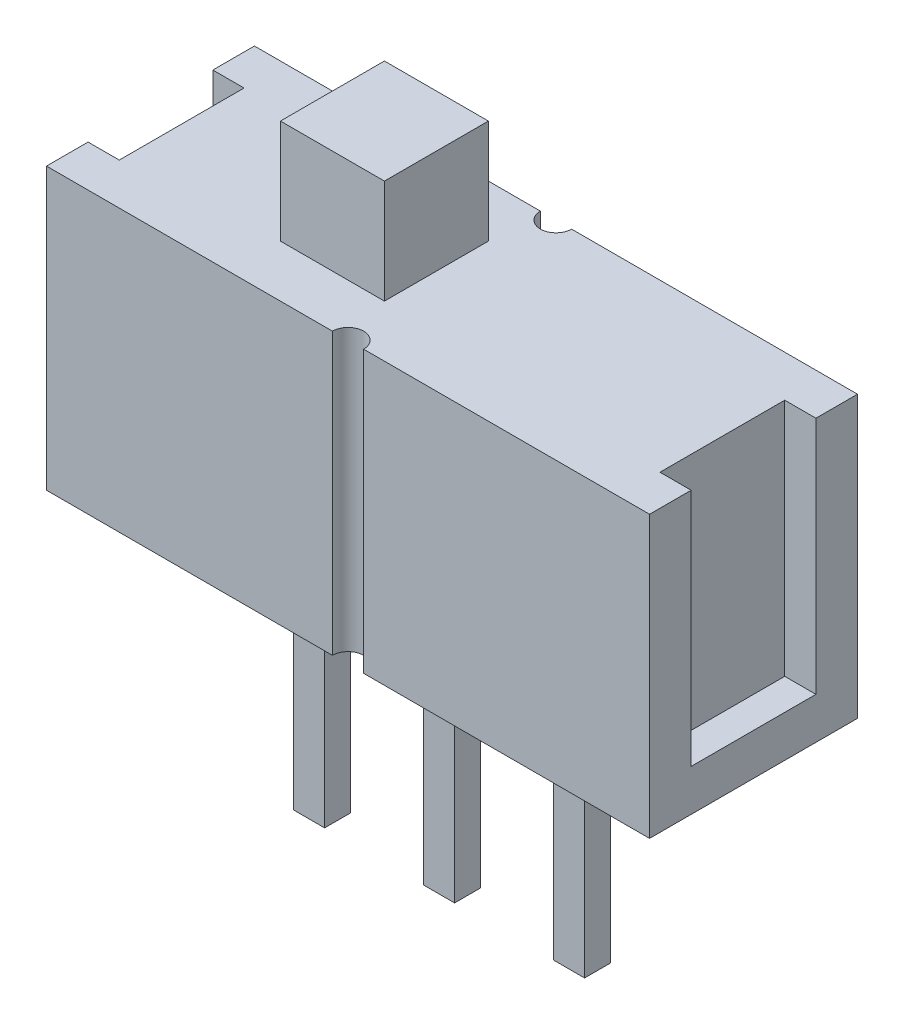
from build123d import *

# Parameters (mm, degrees)
BOSS_EXTRUDE1_DEPTH = 5.4
SKETCH3_W           = 0.6
SKETCH3_H           = 0.5
BOSS_EXTRUDE3_DEPTH = 4.7
SKETCH4_W           = 2
SKETCH4_H           = 2
BOSS_EXTRUDE4_DEPTH = 2
SKETCH5_W           = 1.2
SKETCH5_H           = 2.4
CUT_EXTRUDE1_DEPTH  = 4.6


with BuildPart() as part:
    # Sketch1 → Boss-Extrude1 (new body)
    with BuildSketch(Plane(origin=(0, 0, 0), x_dir=(1, 0, 0), z_dir=(0, 1, 0))):
        with BuildLine():
            Line((-5.8, -2), (-0.3, -2))
            ThreePointArc((-0.3, -2), (0, -1.7), (0.3, -2))
            Line((0.3, -2), (5.8, -2))
            Line((5.8, -2), (5.8, 2))
            Line((5.8, 2), (0.3, 2))
            ThreePointArc((0.3, 2), (0, 1.7), (-0.3, 2))
            Line((-0.3, 2), (-5.8, 2))
            Line((-5.8, 2), (-5.8, -2))
        make_face()
    extrude(amount=BOSS_EXTRUDE1_DEPTH)

    # Sketch3 → Boss-Extrude3 (add)
    with BuildSketch(Plane.XZ):
        Rectangle(SKETCH3_W, SKETCH3_H)
        with Locations((2.5, 0)):
            Rectangle(SKETCH3_W, SKETCH3_H)
        with Locations((-2.5, 0)):
            Rectangle(SKETCH3_W, SKETCH3_H)
    extrude(amount=BOSS_EXTRUDE3_DEPTH)

    # Sketch4 → Boss-Extrude4 (add)
    with BuildSketch(Plane(origin=(0, 5.4, 0), x_dir=(1, 0, 0), z_dir=(0, 1, 0))):
        with Locations((-1.3, 0)):
            Rectangle(SKETCH4_W, SKETCH4_H)
    extrude(amount=BOSS_EXTRUDE4_DEPTH)

    # Sketch5 → Cut-Extrude1 (cut)
    with BuildSketch(Plane(origin=(0, 5.4, 0), x_dir=(1, 0, 0), z_dir=(0, 1, 0))):
        with Locations((5.8, 0)):
            Rectangle(SKETCH5_W, SKETCH5_H)
    cut_extrude1 = extrude(amount=-CUT_EXTRUDE1_DEPTH, mode=Mode.SUBTRACT)

    # Mirror1: Cut-Extrude1 across plane
    add(cut_extrude1.mirror(Plane(origin=(0, 0, 0), x_dir=(0, 0, 1), z_dir=(1, 0, 0))), mode=Mode.SUBTRACT)


solid = part.part
